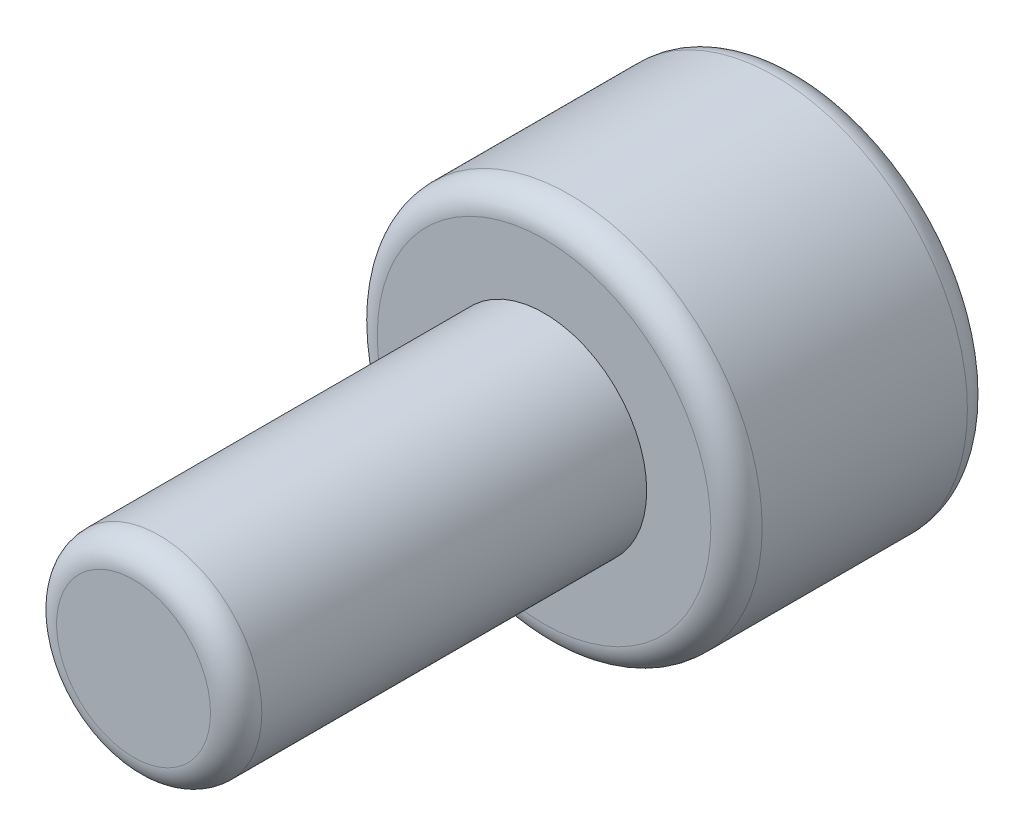
from build123d import *

# Parameters (mm, degrees)
SKETCH_1_R          = 2
EXTRUDE_1_DEPTH     = 8
SKETCH_2_R          = 3.75
EXTRUDE_2_DEPTH     = 5
CUT_EXTRUDE_2_DEPTH = 3
FILLET_1_R          = 0.5


with BuildPart() as part:
    # 草图1 → 凸台-拉伸1 (new body)
    with BuildSketch(Plane.XY):
        Circle(SKETCH_1_R)
    extrude(amount=EXTRUDE_1_DEPTH)

    # 草图2 → 凸台-拉伸2 (add)
    with BuildSketch(Plane(origin=(0, 0, 0), x_dir=(-1, 0, 0), z_dir=(0, 0, -1))):
        Circle(SKETCH_2_R)
    extrude(amount=EXTRUDE_2_DEPTH)

    # 草图4 → 切除-拉伸2 (cut)
    with BuildSketch(Plane(origin=(0, 0, -5), x_dir=(-1, 0, 0), z_dir=(0, 0, -1))):
        Polygon((-1.4, 2.424871131), (1.4, 2.424871131), (2.8, 0), (1.4, -2.424871131), (-1.4, -2.424871131), (-2.8, 0), align=None)
    extrude(amount=-CUT_EXTRUDE_2_DEPTH, mode=Mode.SUBTRACT)

    # 圆角1
    fillet_1_edges = [part.edges().sort_by_distance(p)[0] for p in [
        (-1.4, 2.424871131, -3.5),
        (-2.8, 0, -3.5),
        (-1.4, -2.424871131, -3.5),
        (1.4, -2.424871131, -3.5),
        (2.8, 0, -3.5),
        (1.4, 2.424871131, -3.5),
        (-2, 0, 8),
        (3.75, 0, 0),
        (3.75, 0, -5),
    ]]
    fillet(fillet_1_edges, radius=FILLET_1_R)


solid = part.part
